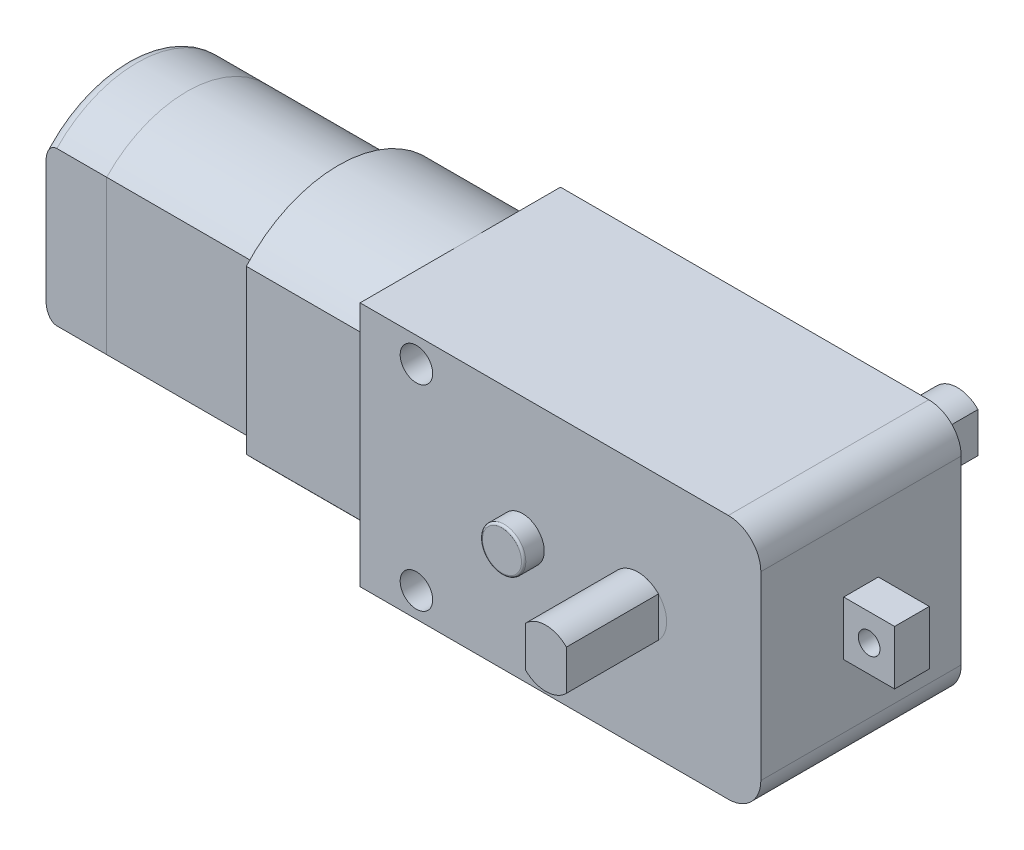
from build123d import *

# Parameters (mm, degrees)
SALIENTE_EXTRUIR1_DEPTH       = 9.25
SALIENTE_EXTRUIR1_DEPTH_BACK  = 9.25
SALIENTE_EXTRUIR2_DEPTH       = 12
CROQUIS3_W                    = 3.2
CROQUIS3_H                    = 5
SALIENTE_EXTRUIR3_DEPTH       = 4.7
CORTAR_EXTRUIR1_DEPTH         = 28
CORTAR_EXTRUIR1_DEPTH_BACK    = 17.7
CROQUIS4_R                    = 1.5
CROQUIS5_R                    = 2
SALIENTE_EXTRUIR4_DEPTH       = 1.9
REDONDEO1_R                   = 0.2
CROQUIS6_R                    = 2.65
CORTAR_EXTRUIR2_DEPTH         = 23.9
SALIENTE_EXTRUIR5_DEPTH       = 14
SALIENTE_EXTRUIR6_DEPTH       = 5.6
REDONDEO2_R                   = 1
SALIENTE_EXTRUIR7_DEPTH       = 2
CROQUIS12_R                   = 1
SALIENTE_EXTRUIR8_DEPTH       = 1
CROQUIS13_W                   = 3
CROQUIS13_H                   = 8
SALIENTE_EXTRUIR9_DEPTH       = 1.2
CROQUIS14_R                   = 1
CORTAR_EXTRUIR3_DEPTH         = 4.2
SALIENTE_EXTRUIR10_DEPTH      = 17.75
SALIENTE_EXTRUIR10_DEPTH_BACK = 20.25
SALIENTE_EXTRUIR11_DEPTH      = 9.25
SALIENTE_EXTRUIR11_DEPTH_BACK = 12.25
CROQUIS16_R                   = 2.65


with BuildPart() as part:
    # Croquis1 → Saliente-Extruir1 (new, two sides: drawn at the far end of the back side and taken through both)
    with BuildSketch(Plane.XY.offset(-SALIENTE_EXTRUIR1_DEPTH_BACK)):
        with BuildLine():
            Line((-18.5, -11.35), (15.5, -11.35))
            ThreePointArc((15.5, -11.35), (17.621320344, -10.471320344), (18.5, -8.35))
            Line((18.5, -8.35), (18.5, 8.35))
            ThreePointArc((18.5, 8.35), (17.621320344, 10.471320344), (15.5, 11.35))
            Line((15.5, 11.35), (-18.5, 11.35))
            Line((-18.5, 11.35), (-18.5, -11.35))
        make_face()
    extrude(amount=SALIENTE_EXTRUIR1_DEPTH + SALIENTE_EXTRUIR1_DEPTH_BACK)

    # Croquis2 → Saliente-Extruir2 (add)
    with BuildSketch(Plane.ZY.offset(18.5)):
        with BuildLine():
            Line((7.75, -7.521469271), (7.75, 7.521469271))
            ThreePointArc((7.75, 7.521469271), (-0.75, 11.35), (-9.25, 7.521469271))
            Line((-9.25, 7.521469271), (-9.25, -7.521469271))
            ThreePointArc((-9.25, -7.521469271), (-0.75, -11.35), (7.75, -7.521469271))
        make_face()
    extrude(amount=SALIENTE_EXTRUIR2_DEPTH)

    # Croquis3 → Saliente-Extruir3 (add)
    with BuildSketch(Plane(origin=(18.5, 0, 0), x_dir=(0, 0, -1), z_dir=(1, 0, 0))):
        Rectangle(CROQUIS3_W, CROQUIS3_H)
    extrude(amount=SALIENTE_EXTRUIR3_DEPTH)

    # Croquis4 → Cortar-Extruir1 (cut, two sides: drawn at the far end of the back side and taken through both)
    with BuildSketch(Plane.XY.offset(-CORTAR_EXTRUIR1_DEPTH_BACK)):
        with Locations(Location((-13.3, 9.05, 0), (0, 0, 180))):
            Circle(CROQUIS4_R)
        with Locations(Location((-13.3, -9.05, 0), (0, 0, 180))):
            Circle(CROQUIS4_R)
    extrude(amount=CORTAR_EXTRUIR1_DEPTH + CORTAR_EXTRUIR1_DEPTH_BACK, mode=Mode.SUBTRACT)

    # Croquis5 → Saliente-Extruir4 (add)
    with BuildSketch(Plane.XY.offset(9.25)):
        with Locations(Location((-3.5, 0, 0), (0, 0, 180))):
            Circle(CROQUIS5_R)
    extrude(amount=SALIENTE_EXTRUIR4_DEPTH)

    # Redondeo1
    redondeo1_edges = [part.edges().sort_by_distance(p)[0] for p in [
        (-1.5, 0, 11.15),
    ]]
    fillet(redondeo1_edges, radius=REDONDEO1_R)

    # Croquis6 → Cortar-Extruir2 (cut)
    with BuildSketch(Plane.XY.offset(9.25)):
        with Locations((7.15, 0)):
            Circle(CROQUIS6_R)
    extrude(amount=-CORTAR_EXTRUIR2_DEPTH, mode=Mode.SUBTRACT)

    # Croquis14 → Cortar-Extruir3 (cut)
    with BuildSketch(Plane.XY.offset(1.6)):
        with Locations((20.85, 0)):
            Circle(CROQUIS14_R)
    extrude(amount=-CORTAR_EXTRUIR3_DEPTH, mode=Mode.SUBTRACT)


with BuildPart() as body_2:
    # Croquis9 → Saliente-Extruir5 (new body)
    with BuildSketch(Plane.ZY.offset(30.5)):
        with BuildLine():
            Line((6.65, -7.092425537), (6.65, 7.092425537))
            ThreePointArc((6.65, 7.092425537), (-0.75, 10.25), (-8.15, 7.092425537))
            Line((-8.15, 7.092425537), (-8.15, -7.092425537))
            ThreePointArc((-8.15, -7.092425537), (-0.75, -10.25), (6.65, -7.092425537))
        make_face()
    extrude(amount=SALIENTE_EXTRUIR5_DEPTH)


with BuildPart() as body_3:
    # Croquis10 → Saliente-Extruir6 (new body)
    with BuildSketch(Plane.ZY.offset(44.5)):
        with BuildLine():
            Line((-8.15, 7.092425537), (-8.15, -7.092425537))
            ThreePointArc((-8.15, -7.092425537), (-0.75, -10.25), (6.65, -7.092425537))
            Line((6.65, -7.092425537), (6.65, 7.092425537))
            ThreePointArc((6.65, 7.092425537), (-0.75, 10.25), (-8.15, 7.092425537))
        make_face()
    extrude(amount=SALIENTE_EXTRUIR6_DEPTH)

    # Redondeo2
    redondeo2_edges = [body_3.edges().sort_by_distance(p)[0] for p in [
        (-50.1, -10.25, -0.75),
        (-50.1, 10.25, -0.75),
    ]]
    fillet(redondeo2_edges, radius=REDONDEO2_R)


with BuildPart() as body_4:
    # Croquis11 → Saliente-Extruir7 (new body)
    with BuildSketch(Plane.ZY.offset(50.1)):
        with BuildLine():
            Line((2.65, 3.666060556), (2.65, -3.666060556))
            ThreePointArc((2.65, -3.666060556), (-5.75, 0), (2.65, 3.666060556))
        make_face()
    extrude(amount=SALIENTE_EXTRUIR7_DEPTH)


with BuildPart() as body_5:
    # Croquis12 → Saliente-Extruir8 (new body)
    with BuildSketch(Plane.ZY.offset(52.1)):
        with Locations((-0.75, 0)):
            Circle(CROQUIS12_R)
    extrude(amount=SALIENTE_EXTRUIR8_DEPTH)


with BuildPart() as body_6:
    # Croquis13 → Saliente-Extruir9 (new body)
    with BuildSketch(Plane(origin=(0, 0, -8.15), x_dir=(-1, 0, 0), z_dir=(0, 0, -1))):
        with Locations((46, 0)):
            Rectangle(CROQUIS13_W, CROQUIS13_H)
    extrude(amount=SALIENTE_EXTRUIR9_DEPTH)


with BuildPart() as body_7:
    # Croquis15 → Saliente-Extruir10 (new, two sides: drawn at the far end of the back side and taken through both)
    with BuildSketch(Plane.XY.offset(-SALIENTE_EXTRUIR10_DEPTH_BACK)):
        with BuildLine():
            Line((9.05, -1.84729532), (9.05, 1.84729532))
            ThreePointArc((9.05, 1.84729532), (7.15, 2.65), (5.25, 1.84729532))
            Line((5.25, 1.84729532), (5.25, -1.84729532))
            ThreePointArc((5.25, -1.84729532), (7.15, -2.65), (9.05, -1.84729532))
        make_face()
    extrude(amount=SALIENTE_EXTRUIR10_DEPTH + SALIENTE_EXTRUIR10_DEPTH_BACK)


with BuildPart() as body_8:
    # Croquis16 → Saliente-Extruir11 (new, two sides: drawn at the far end of the back side and taken through both)
    with BuildSketch(Plane.XY.offset(-SALIENTE_EXTRUIR11_DEPTH_BACK)):
        with Locations((7.15, 0)):
            Circle(CROQUIS16_R)
    extrude(amount=SALIENTE_EXTRUIR11_DEPTH + SALIENTE_EXTRUIR11_DEPTH_BACK)


solid = Compound([part.part, body_2.part, body_3.part, body_4.part, body_5.part, body_6.part, body_7.part, body_8.part])
